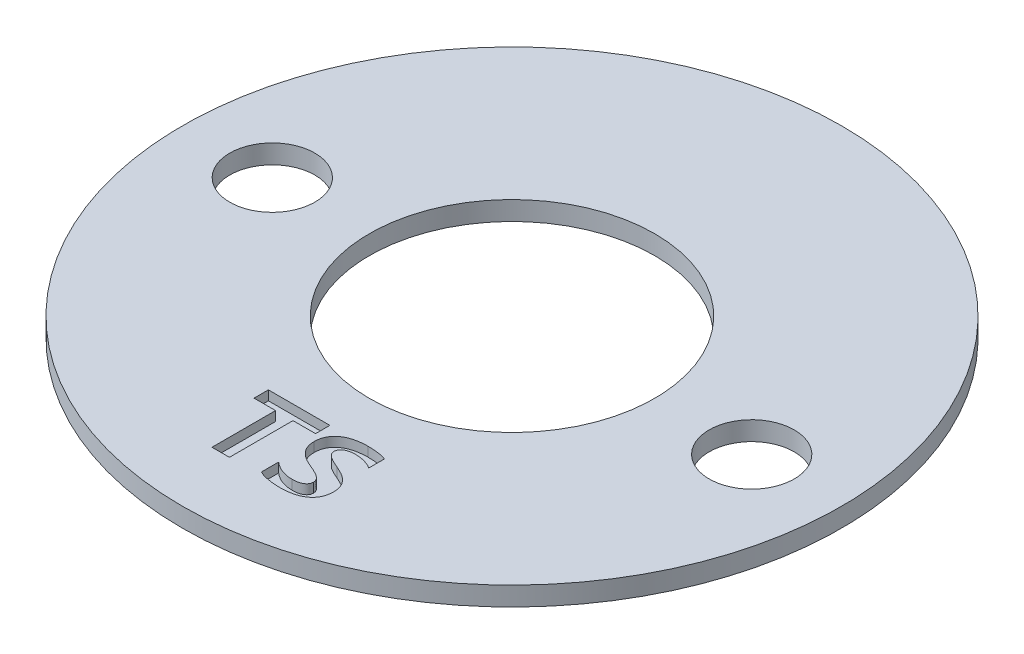
from build123d import *

# Parameters (mm, degrees)
SKETCH1_R           = 27.5
BOSS_EXTRUDE1_DEPTH = 1.5875
SKETCH4_R           = 3.55
SKETCH4_R_2         = 11.90625
CUT_EXTRUDE2_DEPTH  = 39.923259836
CUT_EXTRUDE1_DEPTH  = 0.79375


with BuildPart() as part:
    # Sketch1 → Boss-Extrude1 (new body)
    with BuildSketch(Plane(origin=(0, 0, 0), x_dir=(1, 0, 0), z_dir=(0, 1, 0))):
        with Locations(Location((0, 0, 0), (0, 0, 270))):
            Circle(SKETCH1_R)
    extrude(amount=BOSS_EXTRUDE1_DEPTH)

    # Sketch4 → Cut-Extrude2 (cut, through all)
    with BuildSketch(Plane.XZ):
        with Locations(Location((-20.0025, 0, 0), (0, 0, 270))):
            Circle(SKETCH4_R)
        with Locations(Location((0, 0, 0), (0, 0, 270))):
            Circle(SKETCH4_R_2)
        with Locations(Location((20.0025, 0, 0), (0, 0, 270))):
            Circle(SKETCH4_R)
    extrude(amount=-CUT_EXTRUDE2_DEPTH, mode=Mode.SUBTRACT)

    # Sketch2 → Cut-Extrude1 (cut)
    with BuildSketch(Plane(origin=(0, 1.5875, 0), x_dir=(1, 0, 0), z_dir=(0, 1, 0))):
        Polygon((0.302631579, -16.697368421), (-1.578947368, -16.697368421), (-1.578947368, -22), (-3.032894737, -22), (-3.032894737, -16.697368421), (-4.828947368, -16.697368421), (-4.828947368, -15.5), (0.302631579, -15.5), align=None)
        with BuildLine():
            Line((0.815789474, -21.72604852), (0.815789474, -20.289473684))
            add(Edge.make_bspline(
                [(0.815789474, -20.289473684), (0.882551721, -20.344188934), (1.014523687, -20.452347051), (1.227140713, -20.591115516), (1.447202728, -20.71001818), (1.675409001, -20.805403848), (1.908305656, -20.880763679), (2.143159037, -20.933694233), (2.379219718, -20.967619991), (2.536893399, -20.971660738), (2.615851151, -20.973684211)],
                knots=[0, 0, 0, 0, 1.052804814, 2.08112707, 3.092934838, 4.101597725, 5.095309197, 6.076510114, 7.036780032, 8, 8, 8, 8], degree=3))
            add(Edge.make_bspline(
                [(2.615851151, -20.973684211), (2.66087259, -20.973477518), (2.747938401, -20.9730778), (2.873639842, -20.961370885), (2.99073314, -20.94618485), (3.099082786, -20.923092555), (3.199279135, -20.895566542), (3.290917674, -20.86202374), (3.37356266, -20.823444156), (3.448177848, -20.780561289), (3.513594969, -20.732584572), (3.570415866, -20.680375528), (3.617618767, -20.623446094), (3.669442478, -20.543663794), (3.713452108, -20.432106591), (3.720266055, -20.338011829), (3.723684211, -20.290810033)],
                knots=[0, 0, 0, 0, 1.302764252, 2.519382516, 3.651968008, 4.719312502, 5.723721354, 6.658045591, 7.540747622, 8.361350842, 9.145473591, 9.884614119, 10.589667965, 11.280062621, 12.635567738, 14, 14, 14, 14], degree=3))
            add(Edge.make_bspline(
                [(3.723684211, -20.290810033), (3.722426598, -20.25997207), (3.719956321, -20.199398327), (3.69958044, -20.111022196), (3.664000491, -20.028974033), (3.616091236, -19.951631438), (3.556666419, -19.878233023), (3.487201128, -19.807648429), (3.407444856, -19.74029614), (3.284273886, -19.653302777), (3.10732717, -19.54775519), (2.867024513, -19.432171656), (2.601198691, -19.31429187), (2.415131632, -19.237352446), (2.319181743, -19.197676809)],
                knots=[0, 0, 0, 0, 0.590934481, 1.160748317, 1.727158715, 2.298507061, 2.900148301, 3.534378593, 4.194980596, 4.898998642, 6.423979724, 8.139194984, 10.009084388, 12, 12, 12, 12], degree=3))
            add(Edge.make_bspline(
                [(2.319181743, -19.197676809), (2.25788199, -19.17109541), (2.13808586, -19.119148238), (1.966708906, -19.032893283), (1.806493367, -18.944235596), (1.658517988, -18.850434485), (1.523442829, -18.751509678), (1.400085763, -18.64808955), (1.287457443, -18.541920664), (1.187708549, -18.43018436), (1.1001457, -18.312988169), (1.023877944, -18.190158763), (0.959369951, -18.061355383), (0.907178809, -17.926536043), (0.86553669, -17.786288337), (0.836246584, -17.639602069), (0.818473996, -17.487149218), (0.816692804, -17.383409336), (0.815789474, -17.330797697)],
                knots=[0, 0, 0, 0, 1.250860862, 2.444517047, 3.590871071, 4.678394788, 5.722744029, 6.723411862, 7.690959296, 8.618453783, 9.5242799, 10.426990097, 11.322232235, 12.217513229, 13.130682761, 14.058177248, 15.015205389, 16, 16, 16, 16], degree=3))
            add(Edge.make_bspline(
                [(0.815789474, -17.330797697), (0.818445505, -17.24958618), (0.823597707, -17.092051084), (0.860733455, -16.864521582), (0.924971912, -16.654859183), (1.016007936, -16.463914802), (1.126913051, -16.288854456), (1.259943872, -16.132191858), (1.408209222, -15.98883825), (1.57720384, -15.865185708), (1.760454764, -15.755197728), (1.958989864, -15.661820169), (2.171218494, -15.584552959), (2.396012169, -15.521863248), (2.631175245, -15.474928872), (2.874286713, -15.44009323), (3.123695328, -15.417908638), (3.292442744, -15.415625465), (3.377569901, -15.414473684)],
                knots=[0, 0, 0, 0, 1.081198718, 2.097322509, 3.059813659, 3.991166944, 4.906054364, 5.811353855, 6.721769168, 7.6459357, 8.59302305, 9.564157515, 10.562518314, 11.597307653, 12.668715501, 13.753374479, 14.866656162, 16, 16, 16, 16], degree=3))
            add(Edge.make_bspline(
                [(3.377569901, -15.414473684), (3.459987869, -15.415328313), (3.619994963, -15.416987499), (3.853159002, -15.427349754), (4.071558284, -15.446058754), (4.277161442, -15.471317206), (4.471658491, -15.504592658), (4.657344536, -15.546621391), (4.836054655, -15.593272055), (4.950256153, -15.633727811), (5.006578947, -15.653680099)],
                knots=[0, 0, 0, 0, 1.195237994, 2.320447403, 3.383723621, 4.373269299, 5.323774543, 6.243759987, 7.133843727, 8, 8, 8, 8], degree=3))
            Line((5.006578947, -15.653680099), (5.006578947, -16.953947368))
            add(Edge.make_bspline(
                [(5.006578947, -16.953947368), (4.950172841, -16.919417089), (4.834918543, -16.848861552), (4.648222275, -16.763029921), (4.452438329, -16.687693178), (4.250017568, -16.628897123), (4.045825372, -16.581321754), (3.843357111, -16.55035981), (3.646561557, -16.530718962), (3.517929378, -16.527761058), (3.455078125, -16.526315789)],
                knots=[0, 0, 0, 0, 0.973185875, 1.988505531, 3.020409709, 4.060289755, 5.089876897, 6.105810916, 7.074476093, 8, 8, 8, 8], degree=3))
            add(Edge.make_bspline(
                [(3.455078125, -16.526315789), (3.375169145, -16.528271218), (3.221521244, -16.53203109), (3.004767156, -16.569942483), (2.814066446, -16.626970822), (2.653815081, -16.70701684), (2.524891785, -16.806893537), (2.443308815, -16.906260816), (2.397741766, -16.993326378), (2.373865074, -17.061787316), (2.358331899, -17.134114289), (2.356304358, -17.183717359), (2.355263158, -17.209189967)],
                knots=[0, 0, 0, 0, 1.666493883, 3.204311803, 4.577720999, 5.808610471, 6.920989002, 7.959277989, 8.462502887, 8.965384053, 9.468694847, 10, 10, 10, 10], degree=3))
            add(Edge.make_bspline(
                [(2.355263158, -17.209189967), (2.356264289, -17.235551094), (2.358234991, -17.287442354), (2.374567326, -17.362801103), (2.402045011, -17.433762827), (2.453383319, -17.525132191), (2.547217166, -17.631338354), (2.688292429, -17.751715683), (2.86713992, -17.86247441), (3.075942128, -17.975041667), (3.317681453, -18.084059425), (3.489213426, -18.15617833), (3.579358553, -18.194078947)],
                knots=[0, 0, 0, 0, 0.477042346, 0.939046667, 1.388484856, 1.850770801, 2.82993316, 3.934162149, 5.200672571, 6.629956823, 8.228942609, 10, 10, 10, 10], degree=3))
            add(Edge.make_bspline(
                [(3.579358553, -18.194078947), (3.642418803, -18.220695676), (3.766433485, -18.273040301), (3.944706675, -18.359594534), (4.115266372, -18.44514729), (4.274023112, -18.537137812), (4.424922951, -18.629163804), (4.562535728, -18.730337502), (4.690337429, -18.835876907), (4.807037692, -18.948012462), (4.911345614, -19.067543538), (5.005777242, -19.193316325), (5.081813941, -19.330644509), (5.148791414, -19.474746561), (5.201449594, -19.629060676), (5.236481483, -19.79555739), (5.260393083, -19.973400477), (5.26221865, -20.096509128), (5.263157895, -20.159847862)],
                knots=[0, 0, 0, 0, 1.182142093, 2.324808002, 3.422600261, 4.4772321, 5.493523657, 6.473934373, 7.424665926, 8.355223432, 9.265842699, 10.163099642, 11.065981044, 11.971547163, 12.905946225, 13.874936649, 14.906666431, 16, 16, 16, 16], degree=3))
            add(Edge.make_bspline(
                [(5.263157895, -20.159847862), (5.260698876, -20.246423805), (5.255956928, -20.413376037), (5.21684268, -20.652638228), (5.153319213, -20.871196294), (5.061633909, -21.067198456), (4.947311835, -21.243154326), (4.81499893, -21.401271052), (4.663257063, -21.541638016), (4.494440069, -21.664634165), (4.308811924, -21.770101447), (4.109066808, -21.859488309), (3.894942021, -21.933562285), (3.667444469, -21.989651833), (3.429313461, -22.03179399), (3.183972553, -22.06221662), (2.931981847, -22.081521047), (2.761993293, -22.084180669), (2.675986842, -22.085526316)],
                knots=[0, 0, 0, 0, 1.135948082, 2.190551571, 3.17297232, 4.114787176, 5.019868708, 5.920575964, 6.814327848, 7.726634493, 8.65648264, 9.611815768, 10.59564518, 11.626721736, 12.684287895, 13.768626863, 14.871027011, 16, 16, 16, 16], degree=3))
            add(Edge.make_bspline(
                [(2.675986842, -22.085526316), (2.5873109, -22.084656233), (2.412455192, -22.08294056), (2.153423566, -22.064606065), (1.901063457, -22.036772954), (1.656381842, -21.999013651), (1.423487146, -21.948401798), (1.205239595, -21.887748169), (1.003210107, -21.814418992), (0.877301726, -21.755052086), (0.815789474, -21.72604852)],
                knots=[0, 0, 0, 0, 1.113719809, 2.196089038, 3.260137412, 4.302409517, 5.30443291, 6.252114794, 7.146074671, 8, 8, 8, 8], degree=3))
        make_face()
    extrude(amount=-CUT_EXTRUDE1_DEPTH, mode=Mode.SUBTRACT)


solid = part.part
